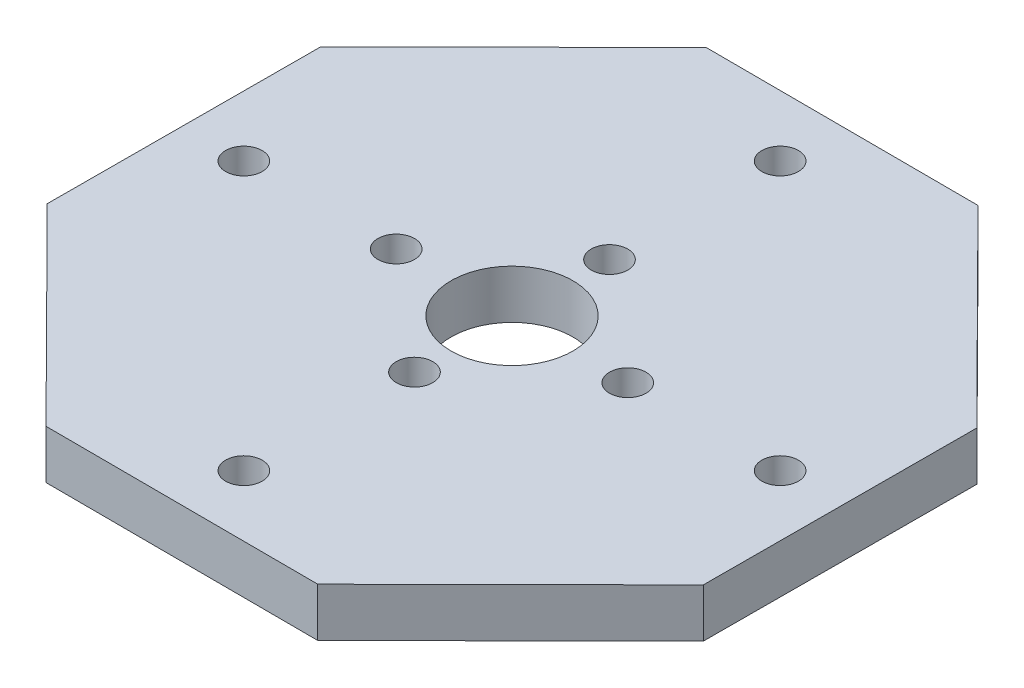
from build123d import *

# Parameters (mm, degrees)
SKETCH1_R           = 1.5
SKETCH1_R_2         = 5
BOSS_EXTRUDE1_DEPTH = 2


with BuildPart() as part:
    # Sketch1 → Boss-Extrude1 (new, symmetric)
    with BuildSketch(Plane(origin=(0, 0, 0), x_dir=(1, 0, 0), z_dir=(0, 1, 0))):
        Polygon((11.27052257, 26.963900813), (-11.096894175, 27.035820049), (-26.963900813, 11.27052257), (-27.035820049, -11.096894175), (-11.27052257, -26.963900813), (11.096894175, -27.035820049), (26.963900813, -11.27052257), (27.035820049, 11.096894175), align=None)
        with Locations(Location((0, 22, 0), (0, 0, 270))):
            Circle(SKETCH1_R, mode=Mode.SUBTRACT)
        with Locations(Location((22, 0, 0), (0, 0, 270))):
            Circle(SKETCH1_R, mode=Mode.SUBTRACT)
        with Locations(Location((0, -22, 0), (0, 0, 270))):
            Circle(SKETCH1_R, mode=Mode.SUBTRACT)
        with Locations(Location((-22, 0, 0), (0, 0, 270))):
            Circle(SKETCH1_R, mode=Mode.SUBTRACT)
        with Locations(Location((0, 0, 0), (0, 0, 270))):
            Circle(SKETCH1_R_2, mode=Mode.SUBTRACT)
        with Locations(Location((-9.5, 0, 0), (0, 0, 270))):
            Circle(SKETCH1_R, mode=Mode.SUBTRACT)
        with Locations(Location((0, -8, 0), (0, 0, 270))):
            Circle(SKETCH1_R, mode=Mode.SUBTRACT)
        with Locations(Location((9.5, 0, 0), (0, 0, 270))):
            Circle(SKETCH1_R, mode=Mode.SUBTRACT)
        with Locations(Location((0, 8, 0), (0, 0, 270))):
            Circle(SKETCH1_R, mode=Mode.SUBTRACT)
    extrude(amount=BOSS_EXTRUDE1_DEPTH, both=True)


solid = part.part
